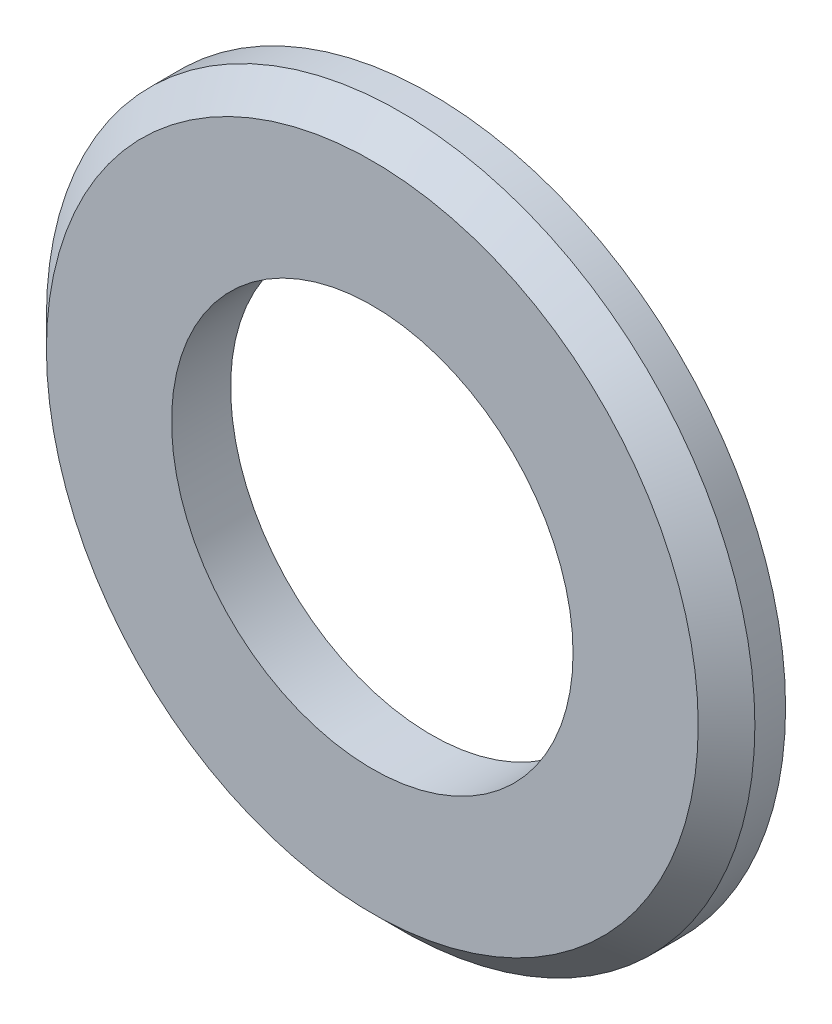
from build123d import *

# Parameters (mm, degrees)
SKETCH_1_R      = 15
SKETCH_1_R_2    = 8.5
EXTRUDE_1_DEPTH = 2.5
CHAMFER_1_SIZE  = 1.2


with BuildPart() as part:
    # Эскиз1 → Бобышка-Вытянуть1 (new body)
    with BuildSketch(Plane.XY):
        Circle(SKETCH_1_R)
        Circle(SKETCH_1_R_2, mode=Mode.SUBTRACT)
    extrude(amount=EXTRUDE_1_DEPTH)

    # Фаска1
    chamfer_1_edges = [part.edges().sort_by_distance(p)[0] for p in [
        (-15, 0, 2.5),
    ]]
    chamfer(chamfer_1_edges, length=CHAMFER_1_SIZE)


solid = part.part
